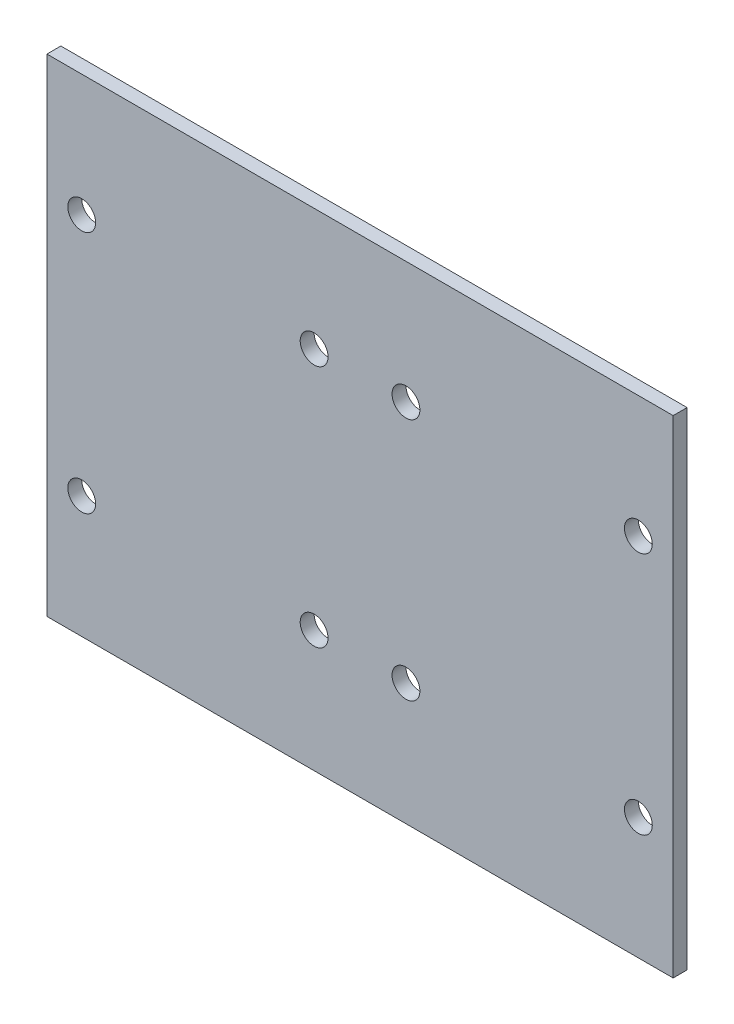
from build123d import *

# Parameters (mm, degrees)
SKETCH1_W           = 90
SKETCH1_H           = 70
SKETCH1_R           = 2
BOSS_EXTRUDE1_DEPTH = 2


with BuildPart() as part:
    # Sketch1 → Boss-Extrude1 (new body)
    with BuildSketch(Plane.XY):
        Rectangle(SKETCH1_W, SKETCH1_H)
        with Locations((-6.6, 17.5)):
            Circle(SKETCH1_R, mode=Mode.SUBTRACT)
        with Locations((6.6, 17.5)):
            Circle(SKETCH1_R, mode=Mode.SUBTRACT)
        with Locations((-6.6, -17.5)):
            Circle(SKETCH1_R, mode=Mode.SUBTRACT)
        with Locations((-40, 17.5)):
            Circle(SKETCH1_R, mode=Mode.SUBTRACT)
        with Locations((-40, -17.5)):
            Circle(SKETCH1_R, mode=Mode.SUBTRACT)
        with Locations((40, 17.5)):
            Circle(SKETCH1_R, mode=Mode.SUBTRACT)
        with Locations((6.6, -17.5)):
            Circle(SKETCH1_R, mode=Mode.SUBTRACT)
        with Locations((40, -17.5)):
            Circle(SKETCH1_R, mode=Mode.SUBTRACT)
    extrude(amount=BOSS_EXTRUDE1_DEPTH)


solid = part.part
